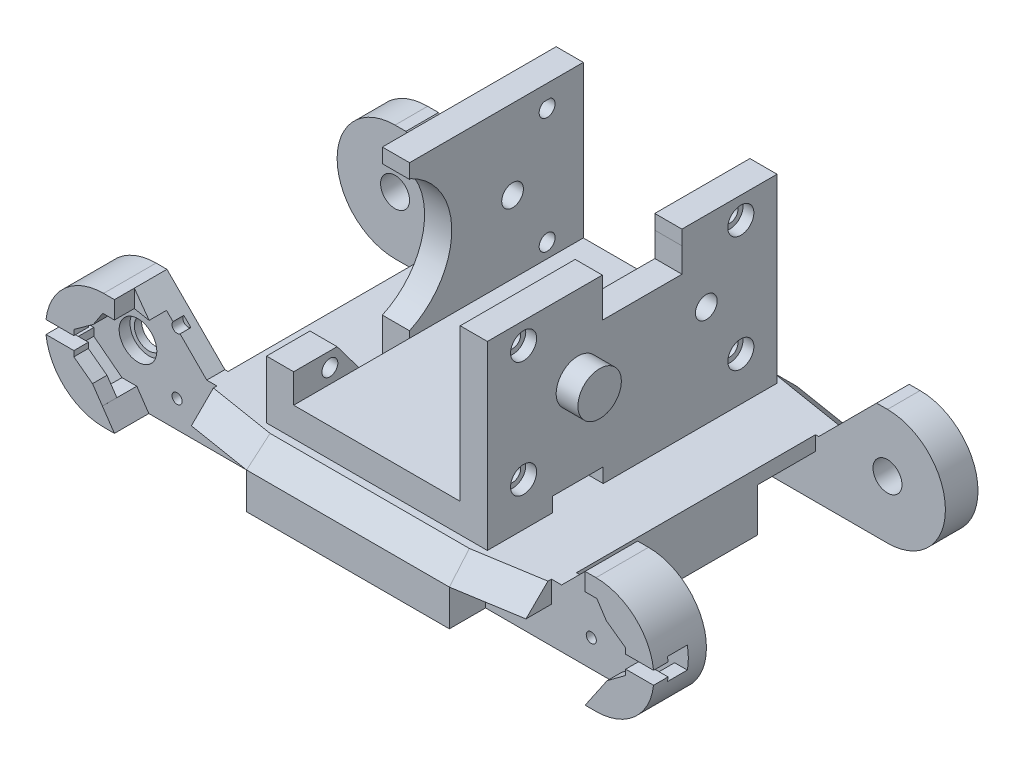
from build123d import *
from build123d.topology import SkipClean

# Parameters (mm, degrees)
CROQUIS1_R                 = 2
SALIENTE_EXTRUIR1_DEPTH    = 24
SALIENTE_EXTRUIR2_START    = -4
CROQUIS2_W                 = 3.75
CROQUIS2_H                 = 24
SALIENTE_EXTRUIR2_DEPTH    = 21
CROQUIS4_R                 = 1.5
CORTAR_EXTRUIR1_DEPTH      = 44.215304002
CORTAR_EXTRUIR2_DEPTH      = 55
CORTAR_EXTRUIR2_DEPTH_BACK = 55
CROQUIS5_W                 = 40
CROQUIS5_H                 = 33
CHAFL_N1_SIZE              = 1
CORTAR_EXTRUIR5_DEPTH      = 17
CORTAR_EXTRUIR6_DEPTH      = 67.068146637
CORTAR_EXTRUIR6_DEPTH_BACK = 2
CHAMFER1_SIZE              = 3
CROQUIS10_R                = 0.7
CROQUIS10_R_2              = 2.6
CORTAR_EXTRUIR7_DEPTH      = 1.5
SKETCH1_W                  = 11.5
SKETCH1_H                  = 34
BOSS_EXTRUDE1_DEPTH        = 4
SKETCH4_R                  = 0.8
SKETCH4_W                  = 6
SKETCH4_H                  = 4
BOSS_EXTRUDE2_DEPTH        = 3.75
BOSS_EXTRUDE6_START        = 21.75
BOSS_EXTRUDE6_DEPTH        = 0.75
BOSS_EXTRUDE8_START        = 23.75
BOSS_EXTRUDE8_DEPTH        = 2
CUT_EXTRUDE33_DEPTH        = 65.722484501
SKETCH6_W                  = 6
SKETCH6_H                  = 8
CUT_EXTRUDE3_DEPTH         = 6
BOSS_EXTRUDE4_START        = 15.25
SKETCH8_W                  = 19.911870841
SKETCH8_H                  = 22
BOSS_EXTRUDE4_DEPTH        = 3.75
SKETCH5_R                  = 1.1
CUT_EXTRUDE2_DEPTH         = 67.554958493
SKETCH19_R                 = 1.1
CUT_EXTRUDE39_DEPTH        = 67.554958493
SKETCH14_R                 = 3
BOSS_EXTRUDE5_DEPTH        = 3
CUT_EXTRUDE37_START        = 15.25
SKETCH17_W                 = 11
SKETCH17_H                 = 4.4
CUT_EXTRUDE37_DEPTH        = 26.75
BOSS_EXTRUDE9_START        = -17
BOSS_EXTRUDE9_DEPTH        = 3
BOSS_EXTRUDE10_START       = 23
SKETCH29_W                 = 3.75
SKETCH29_H                 = 13.133846787
SKETCH29_H_2               = 12.875
SKETCH29_H_3               = 24
BOSS_EXTRUDE10_DEPTH       = 2
SKETCH18_R                 = 1.8
CUT_EXTRUDE38_DEPTH        = 1.5
LPATTERN1_COUNT            = 2
LPATTERN1_PITCH            = 30
LPATTERN1_COUNT_DIR2       = 2
LPATTERN1_PITCH_DIR2       = 16
CUT_EXTRUDE45_START        = -13.75
SKETCH22_R                 = 1.8
CUT_EXTRUDE45_DEPTH        = 1.5
BOSS_EXTRUDE11_START       = 17
BOSS_EXTRUDE11_DEPTH       = 3


with BuildPart() as part:
    # Croquis1 → Saliente-Extruir1 (new, symmetric)
    with BuildSketch(Plane.XY):
        with BuildLine():
            Line((0, 0), (24.5, 0))
            Line((24.5, 0), (32.5, 8))
            Line((32.5, 8), (34, 8))
            ThreePointArc((34, 8), (42, 0), (34, -8))
            Line((34, -8), (0, -8))
            Line((0, -8), (0, 0))
        make_face()
        with Locations((34, 0)):
            Circle(CROQUIS1_R, mode=Mode.SUBTRACT)
    extrude(amount=SALIENTE_EXTRUIR1_DEPTH, both=True)

    # Croquis2 → Saliente-Extruir2 (add)
    with BuildSketch(Plane(origin=(0, 0, 0), x_dir=(-1, 0, 0), z_dir=(0, 0, -1)).offset(SALIENTE_EXTRUIR2_START)):
        with Locations((-13.375, 12)):
            Rectangle(CROQUIS2_W, CROQUIS2_H)
    extrude(amount=SALIENTE_EXTRUIR2_DEPTH)

    # Croquis4 → Cortar-Extruir1 (cut, through all)
    with BuildSketch(Plane(origin=(15.25, 0, 0), x_dir=(0, 0, -1), z_dir=(1, 0, 0))):
        with Locations(Location((10.23, 14, 0), (0, 0, 90))):
            Circle(CROQUIS4_R)
    extrude(amount=-CORTAR_EXTRUIR1_DEPTH, mode=Mode.SUBTRACT)

    # Croquis5 → Cortar-Extruir2 (cut, two sides: drawn at the far end of the back side and taken through both)
    with BuildSketch(Plane(origin=(0, 0, 0), x_dir=(1, 0, 0), z_dir=(0, 1, 0)).offset(-CORTAR_EXTRUIR2_DEPTH_BACK)):
        Polygon((14, 24), (32.5, 21), (42, 21), (42, 24), align=None)
        with Locations((44.05835875, 0)):
            Rectangle(CROQUIS5_W, CROQUIS5_H)
        Polygon((42, -24), (14, -24), (32.5, -21), (42, -21), align=None)
    extrude(amount=CORTAR_EXTRUIR2_DEPTH + CORTAR_EXTRUIR2_DEPTH_BACK, mode=Mode.SUBTRACT)

    # Chaflán1
    chafl_n1_edges = [part.edges().sort_by_distance(p)[0] for p in [
        (13.375, 24, -17),
    ]]
    chamfer(chafl_n1_edges, length=CHAFL_N1_SIZE)

    # Croquis8 → Cortar-Extruir5 (cut)
    with BuildSketch(Plane(origin=(15.25, 0, 0), x_dir=(0, 0, -1), z_dir=(1, 0, 0))):
        with BuildLine():
            ThreePointArc((-4, 4.901688578), (0.248437549, 8.596333977), (1.829582627, 14))
            Line((1.829582627, 14), (-4, 14))
            Line((-4, 14), (-4, 4.901688578))
        make_face()
        with BuildLine():
            Line((-4, 14), (1.829582627, 14))
            ThreePointArc((1.829582627, 14), (0.245664707, 19.397715835), (-4, 23.088036065))
            Line((-4, 23.088036065), (-4, 14))
        make_face()
    extrude(amount=-CORTAR_EXTRUIR5_DEPTH, mode=Mode.SUBTRACT)

    # Croquis9 → Cortar-Extruir6 (cut, two sides: drawn at the far end of the back side and taken through both)
    with BuildSketch(Plane.XY.offset(21).offset(-CORTAR_EXTRUIR6_DEPTH_BACK)):
        Polygon((28.1, 5.56), (36.1, 5.56), (40.1, 2.55), (40.1, 1.5), (42.1, 1.5), (42.1, -1.5), (40.1, -1.5), (40.1, -2.55), (36.21122005, -5.56), (28.1, -5.56), (28.1, -4), (23.1, -4), (23.1, 4), (28.1, 4), align=None)
    extrude(amount=CORTAR_EXTRUIR6_DEPTH + CORTAR_EXTRUIR6_DEPTH_BACK, mode=Mode.SUBTRACT)

    # Chamfer1
    chamfer1_edges = [part.edges().sort_by_distance(p)[0] for p in [
        (7, 0, -24),
        (7, 0, 24),
        (18.55, 0, 23.262162162),
        (19.25, 0, -23.148648649),
    ]]
    chamfer(chamfer1_edges, length=CHAMFER1_SIZE)

    # Croquis10 → Cortar-Extruir7 (cut)
    with BuildSketch(Plane.XY.offset(19)):
        with Locations((28.6, 4.25)):
            Circle(CROQUIS10_R)
        with Locations((34, 0)):
            Circle(CROQUIS10_R_2)
        with Locations(Location((28.6, -4.25, 0), (0, 0, 224.415308597))):
            Circle(CROQUIS10_R)
    extrude(amount=-CORTAR_EXTRUIR7_DEPTH, mode=Mode.SUBTRACT)

    # Sketch1 → Boss-Extrude1 (add)
    with BuildSketch(Plane(origin=(0, 0, 0), x_dir=(1, 0, 0), z_dir=(0, 1, 0))):
        with Locations((5.75, 0)):
            Rectangle(SKETCH1_W, SKETCH1_H)
    extrude(amount=BOSS_EXTRUDE1_DEPTH)

    # Sketch4 → Boss-Extrude2 (add)
    # profile 1 of 2: a face of its own
    with BuildSketch(Plane(origin=(11.5, 0, 0), x_dir=(0, 0, -1), z_dir=(1, 0, 0))):
        Polygon((-17, 8), (-17, 4), (-11, 4), (-14, 8), align=None)
        with Locations(Location((-15, 6, 0), (0, 0, 270))):
            Circle(SKETCH4_R, mode=Mode.SUBTRACT)
    # profile 2 of 2: a face of its own
    with BuildSketch(Plane(origin=(11.5, 0, 0), x_dir=(0, 0, -1), z_dir=(1, 0, 0))):
        with Locations((-14, 2)):
            Rectangle(SKETCH4_W, SKETCH4_H)
    extrude(amount=BOSS_EXTRUDE2_DEPTH)

    # Sketch26 → Boss-Extrude6 (add)
    with SkipClean():  # the faces are left unmerged after this step: merging them gives an invalid solid
        with BuildSketch(Plane.XY.offset(BOSS_EXTRUDE6_START)):
            with BuildLine():
                Line((36.21122005, -5.56), (32.5, -5.56))
                Line((32.5, -5.56), (32.5, -8))
                Line((32.5, -8), (34, -8))
                ThreePointArc((34, -8), (39.099019514, -6.164414003), (41.858116823, -1.5))
                Line((41.858116823, -1.5), (40.1, -1.5))
                Line((40.1, -1.5), (40.1, -2.55))
                Line((40.1, -2.55), (36.21122005, -5.56))
            make_face()
            with BuildLine():
                Line((40.1, 1.5), (41.858116823, 1.5))
                ThreePointArc((41.858116823, 1.5), (39.099019514, 6.164414003), (34, 8))
                Line((34, 8), (32.5, 8))
                Line((32.5, 8), (32.5, 5.56))
                Line((32.5, 5.56), (36.1, 5.56))
                Line((36.1, 5.56), (40.1, 2.55))
                Line((40.1, 2.55), (40.1, 1.5))
            make_face()
        extrude(amount=-BOSS_EXTRUDE6_DEPTH)

    # Sketch7 → Boss-Extrude8 (add)
    with SkipClean():  # the faces are left unmerged after this step: merging them gives an invalid solid
        with BuildSketch(Plane.XY.offset(BOSS_EXTRUDE8_START)):
            with BuildLine():
                Line((38.1, 1.643028555), (38.1, 0.893028555))
                Line((38.1, 0.893028555), (41.95, 0.893028555))
                ThreePointArc((41.95, 0.893028555), (39.331780733, 5.964236265), (34, 8))
                Line((34, 8), (32.5, 8))
                Line((32.5, 8), (32.5, 5.56))
                Line((32.5, 5.56), (34.111035947, 5.56))
                Line((34.111035947, 5.56), (35.431557214, 3.56))
                Line((35.431557214, 3.56), (38.1, 1.643028555))
            make_face()
            with BuildLine():
                Line((35.527624111, -3.56), (38.1, -1.643028555))
                Line((38.1, -1.643028555), (38.1, -0.893028555))
                Line((38.1, -0.893028555), (41.95, -0.893028555))
                ThreePointArc((41.95, -0.893028555), (39.331780733, -5.964236265), (34, -8))
                Line((34, -8), (32.5, -8))
                Line((32.5, -8), (32.5, -5.56))
                Line((32.5, -5.56), (34.163829466, -5.56))
                Line((34.163829466, -5.56), (35.527624111, -3.56))
            make_face()
        extrude(amount=-BOSS_EXTRUDE8_DEPTH)

    # Sketch13 → Cut-Extrude33 (cut, through all)
    with SkipClean():  # the faces are left unmerged after this step: merging them gives an invalid solid
        with BuildSketch(Plane.XY.offset(19)):
            Polygon((32.5, -8), (34.162954376, -5.56), (28.1, -5.56), (28.1, -4), (23.1, -4), (23.1, -3), (14, -3), (14, -8), align=None)
        extrude(amount=CUT_EXTRUDE33_DEPTH, mode=Mode.SUBTRACT)

    # Simetría1: part across plane


with BuildPart() as part_1:
    with SkipClean():  # the faces are left unmerged after this step: merging them gives an invalid solid
        add(part.part)
        add(part.part.mirror(Plane(origin=(0, -8, 24), x_dir=(0, 0, 1), z_dir=(1, 0, 0))))

    # Sketch6 → Cut-Extrude3 (cut)
    with SkipClean():  # the faces are left unmerged after this step: merging them gives an invalid solid
        with BuildSketch(Plane.XZ.offset(8)):
            with Locations((21.05835875, -12.5)):
                Rectangle(SKETCH6_W, SKETCH6_H)
            with Locations((-21.05835875, 12.5)):
                Rectangle(SKETCH6_W, SKETCH6_H)
        extrude(amount=-CUT_EXTRUDE3_DEPTH, mode=Mode.SUBTRACT)

    # Sketch8 → Boss-Extrude4 (add)
    with SkipClean():  # the faces are left unmerged after this step: merging them gives an invalid solid
        with BuildSketch(Plane(origin=(0, 0, 0), x_dir=(0, 0, -1), z_dir=(1, 0, 0)).offset(BOSS_EXTRUDE4_START)):
            with Locations((-7.044064579, 13)):
                Rectangle(SKETCH8_W, SKETCH8_H)
        extrude(amount=-BOSS_EXTRUDE4_DEPTH)

    # Sketch5 → Cut-Extrude2 (cut, through all)
    with SkipClean():  # the faces are left unmerged after this step: merging them gives an invalid solid
        with BuildSketch(Plane.ZY.offset(-15.25)):
            with Locations(Location((15, 6, 0), (0, 0, 90))):
                Circle(SKETCH5_R)
            with Locations(Location((15, 22, 0), (0, 0, 90))):
                Circle(SKETCH5_R)
        extrude(amount=CUT_EXTRUDE2_DEPTH, mode=Mode.SUBTRACT)

    # Sketch19 → Cut-Extrude39 (cut, through all)
    with SkipClean():  # the faces are left unmerged after this step: merging them gives an invalid solid
        with BuildSketch(Plane(origin=(15.25, 0, 0), x_dir=(0, 0, -1), z_dir=(1, 0, 0))):
            with Locations(Location((15, 22, 0), (0, 0, 90))):
                Circle(SKETCH19_R)
            with Locations(Location((15, 6, 0), (0, 0, 90))):
                Circle(SKETCH19_R)
        extrude(amount=-CUT_EXTRUDE39_DEPTH, mode=Mode.SUBTRACT)

    # Sketch14 → Boss-Extrude5 (add)
    with SkipClean():  # the faces are left unmerged after this step: merging them gives an invalid solid
        with BuildSketch(Plane(origin=(15.25, 0, 0), x_dir=(0, 0, -1), z_dir=(1, 0, 0))):
            with Locations(Location((-7.5, 14, 0), (0, 0, 270))):
                Circle(SKETCH14_R)
        extrude(amount=BOSS_EXTRUDE5_DEPTH)

    # Sketch17 → Cut-Extrude37 (cut)
    with SkipClean():  # the faces are left unmerged after this step: merging them gives an invalid solid
        with BuildSketch(Plane(origin=(0, 0, 0), x_dir=(0, 0, -1), z_dir=(1, 0, 0)).offset(CUT_EXTRUDE37_START)):
            with Locations((1.375, 21.8)):
                Rectangle(SKETCH17_W, SKETCH17_H)
        extrude(amount=-CUT_EXTRUDE37_DEPTH, mode=Mode.SUBTRACT)

    # Sketch28 → Boss-Extrude9 (add)
    with SkipClean():  # the faces are left unmerged after this step: merging them gives an invalid solid
        with BuildSketch(Plane.XY.offset(BOSS_EXTRUDE9_START)):
            Polygon((15.25, 0), (15.25, 23), (11.5, 23), (11.5, 4), (-11.5, 4), (-11.5, 23), (-15.25, 23), (-15.25, 0), align=None)
        extrude(amount=-BOSS_EXTRUDE9_DEPTH)

    # Sketch29 → Boss-Extrude10 (add)
    with SkipClean():  # the faces are left unmerged after this step: merging them gives an invalid solid
        with BuildSketch(Plane(origin=(0, 0, 0), x_dir=(1, 0, 0), z_dir=(0, 1, 0)).offset(BOSS_EXTRUDE10_START)):
            with Locations((13.375, 13.433076607)):
                Rectangle(SKETCH29_W, SKETCH29_H)
            with Locations((13.375, -10.5625)):
                Rectangle(SKETCH29_W, SKETCH29_H_2)
            with Locations((-13.375, 8)):
                Rectangle(SKETCH29_W, SKETCH29_H_3)
        extrude(amount=BOSS_EXTRUDE10_DEPTH)

    # Sketch18 → Cut-Extrude38 (cut)
    with SkipClean():  # the faces are left unmerged after this step: merging them gives an invalid solid
        with BuildSketch(Plane(origin=(15.25, 0, 0), x_dir=(0, 0, -1), z_dir=(1, 0, 0))):
            with Locations(Location((-15, 22, 0), (0, 0, 90))):
                Circle(SKETCH18_R)
        cut_extrude38 = extrude(amount=-CUT_EXTRUDE38_DEPTH, mode=Mode.SUBTRACT)

    # LPattern1: Cut-Extrude38 2 × 2
    with SkipClean():  # the faces are left unmerged after this step: merging them gives an invalid solid
        with Locations(*[(0, -j * LPATTERN1_PITCH_DIR2, -i * LPATTERN1_PITCH) for i in range(LPATTERN1_COUNT) for j in range(LPATTERN1_COUNT_DIR2) if (i, j) != (0, 0)]):
            add(cut_extrude38, mode=Mode.SUBTRACT)

    # Sketch22 → Cut-Extrude45 (cut)
    with SkipClean():  # the faces are left unmerged after this step: merging them gives an invalid solid
        with BuildSketch(Plane(origin=(0, 0, 0), x_dir=(0, 0, -1), z_dir=(1, 0, 0)).offset(CUT_EXTRUDE45_START)):
            with Locations(Location((-15, 6, 0), (0, 0, 90))):
                Circle(SKETCH22_R)
            with Locations(Location((15, 6, 0), (0, 0, 90))):
                Circle(SKETCH22_R)
            with Locations(Location((15, 22, 0), (0, 0, 90))):
                Circle(SKETCH22_R)
        extrude(amount=-CUT_EXTRUDE45_DEPTH, mode=Mode.SUBTRACT)

    # Sketch30 → Boss-Extrude11 (add)
    with SkipClean():  # the faces are left unmerged after this step: merging them gives an invalid solid
        with BuildSketch(Plane.XY.offset(BOSS_EXTRUDE11_START)):
            Polygon((15.25, 25), (11.5, 25), (11.5, 4), (-11.5, 4), (-11.5, 8), (-15.25, 8), (-15.25, 0), (15.25, 0), align=None)
        extrude(amount=BOSS_EXTRUDE11_DEPTH)


solid = part_1.part
